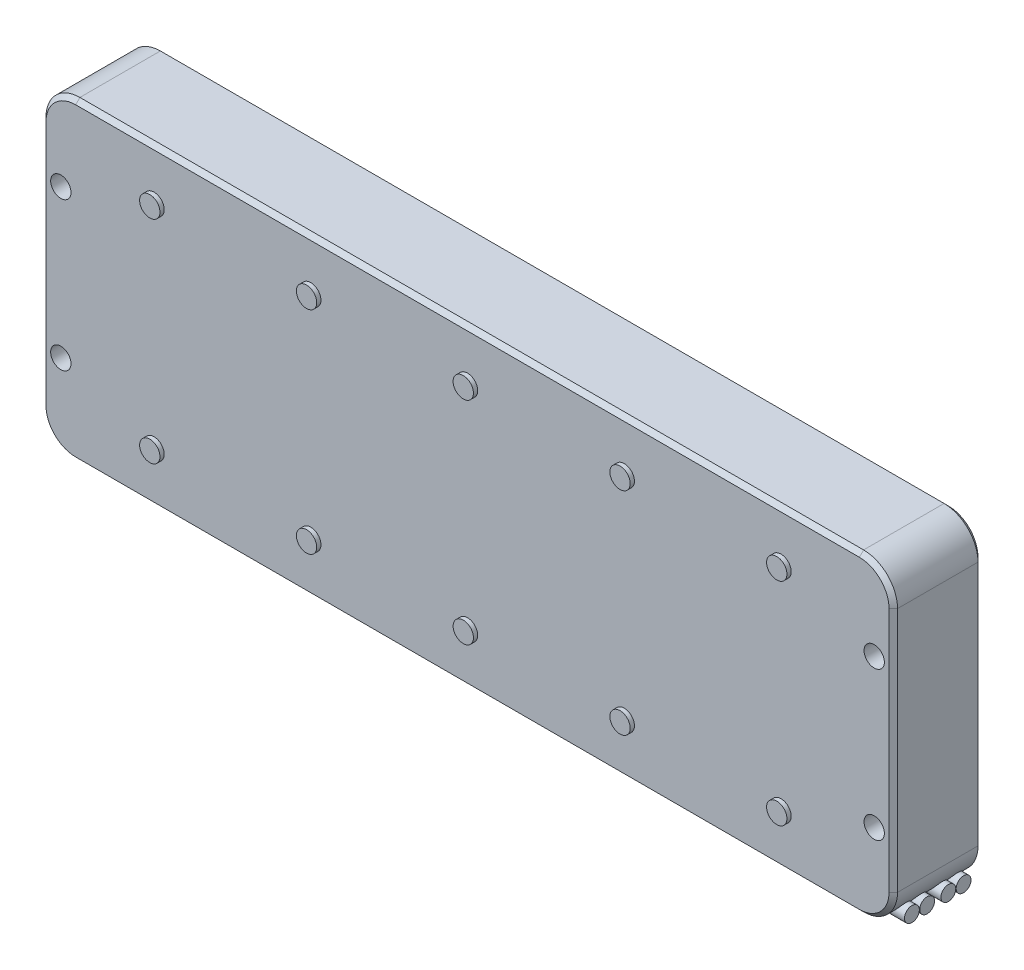
from build123d import *

# Parameters (mm, degrees)
SKETCH1_W           = 201
SKETCH1_H           = 74
BOSS_EXTRUDE1_DEPTH = 21
FILLET1_R           = 8
CHAMFER1_SIZE       = 1
CUT_EXTRUDE1_REACH  = 111.134
SKETCH2_R           = 2.4
SKETCH3_R           = 2.4
BOSS_EXTRUDE2_DEPTH = 1
BOSS_EXTRUDE6_REACH = 207.558
SKETCH4_R           = 1.75
SKETCH5_R           = 2.4
CUT_EXTRUDE2_DEPTH  = 1
SKETCH6_W           = 13
SKETCH6_H           = 9
CUT_EXTRUDE3_DEPTH  = 2.4
SKETCH7_R           = 2
BOSS_EXTRUDE7_DEPTH = 1.25
FILLET2_R           = 2.5
SKETCH8_R           = 2.5
CUT_EXTRUDE4_DEPTH  = 0.25
LPATTERN1_COUNT     = 5
LPATTERN1_PITCH     = 25


with BuildPart() as part:
    # Sketch1 → Boss-Extrude1 (new body)
    with BuildSketch(Plane.XY):
        Rectangle(SKETCH1_W, SKETCH1_H)
    extrude(amount=BOSS_EXTRUDE1_DEPTH)

    # Fillet1
    fillet1_edges = [part.edges().sort_by_distance(p)[0] for p in [
        (100.5, -37, 10.5),
        (-100.5, -37, 10.5),
        (-100.5, 37, 10.5),
        (100.5, 37, 10.5),
    ]]
    fillet(fillet1_edges, radius=FILLET1_R)

    # Chamfer1
    chamfer1_edges = [part.edges().sort_by_distance(p)[0] for p in [
        (0, 37, 0),
        (0, 37, 21),
        (100.5, 0, 0),
        (0, -37, 0),
        (-100.5, 0, 0),
        (-98.156854249, 34.656854249, 0),
        (-98.156854249, -34.656854249, 0),
        (98.156854249, -34.656854249, 0),
        (98.156854249, 34.656854249, 0),
        (100.5, 0, 21),
        (-100.5, 0, 21),
        (0, -37, 21),
        (-98.156854249, 34.656854249, 21),
        (-98.156854249, -34.656854249, 21),
        (98.156854249, -34.656854249, 21),
        (98.156854249, 34.656854249, 21),
    ]]
    chamfer(chamfer1_edges, length=CHAMFER1_SIZE)

    # Sketch2 → Cut-Extrude1 (cut, up to next)
    with BuildSketch(Plane.XY.offset(21), mode=Mode.PRIVATE) as cut_extrude1_sk1:
        with Locations((-96, 17.5)):
            Circle(SKETCH2_R)
    cut_extrude1_tool1 = extrude(cut_extrude1_sk1.sketch, amount=-CUT_EXTRUDE1_REACH, mode=Mode.PRIVATE) & part.part
    # Sketch2 → Cut-Extrude1 (cut, up to next)
    with BuildSketch(Plane.XY.offset(21), mode=Mode.PRIVATE) as cut_extrude1_sk2:
        with Locations((-96, -17.5)):
            Circle(SKETCH2_R)
    cut_extrude1_tool2 = extrude(cut_extrude1_sk2.sketch, amount=-CUT_EXTRUDE1_REACH, mode=Mode.PRIVATE) & part.part
    # Sketch2 → Cut-Extrude1 (cut, up to next)
    with BuildSketch(Plane.XY.offset(21), mode=Mode.PRIVATE) as cut_extrude1_sk3:
        with Locations(Location((96, 17.5, 0), (0, 0, 180))):
            Circle(SKETCH2_R)
    cut_extrude1_tool3 = extrude(cut_extrude1_sk3.sketch, amount=-CUT_EXTRUDE1_REACH, mode=Mode.PRIVATE) & part.part
    # Sketch2 → Cut-Extrude1 (cut, up to next)
    with BuildSketch(Plane.XY.offset(21), mode=Mode.PRIVATE) as cut_extrude1_sk4:
        with Locations(Location((96, -17.5, 0), (0, 0, 180))):
            Circle(SKETCH2_R)
    cut_extrude1_tool4 = extrude(cut_extrude1_sk4.sketch, amount=-CUT_EXTRUDE1_REACH, mode=Mode.PRIVATE) & part.part
    add(cut_extrude1_tool1.solids().sort_by_distance((-96, 17.5, 21))[0], mode=Mode.SUBTRACT)
    add(cut_extrude1_tool2.solids().sort_by_distance((-96, -17.5, 21))[0], mode=Mode.SUBTRACT)
    add(cut_extrude1_tool3.solids().sort_by_distance((96, 17.5, 21))[0], mode=Mode.SUBTRACT)
    add(cut_extrude1_tool4.solids().sort_by_distance((96, -17.5, 21))[0], mode=Mode.SUBTRACT)

    # Sketch3 → Boss-Extrude2 (add)
    with BuildSketch(Plane.XY.offset(21)):
        with Locations(Location((0, 25, 0), (0, 0, 180))):
            Circle(SKETCH3_R)
        with Locations(Location((0, -25, 0), (0, 0, 180))):
            Circle(SKETCH3_R)
        with Locations(Location((-74, 25, 0), (0, 0, 180))):
            Circle(SKETCH3_R)
        with Locations(Location((-37, 25, 0), (0, 0, 180))):
            Circle(SKETCH3_R)
        with Locations(Location((37, 25, 0), (0, 0, 180))):
            Circle(SKETCH3_R)
        with Locations(Location((74, 25, 0), (0, 0, 180))):
            Circle(SKETCH3_R)
        with Locations(Location((74, -25, 0), (0, 0, 180))):
            Circle(SKETCH3_R)
        with Locations(Location((37, -25, 0), (0, 0, 180))):
            Circle(SKETCH3_R)
        with Locations(Location((-37, -25, 0), (0, 0, 180))):
            Circle(SKETCH3_R)
        with Locations(Location((-74, -25, 0), (0, 0, 180))):
            Circle(SKETCH3_R)
    extrude(amount=BOSS_EXTRUDE2_DEPTH)

    # Sketch4 → Boss-Extrude6 (add, up to next)
    with BuildSketch(Plane(origin=(100.5, 0, 0), x_dir=(0, 0, -1), z_dir=(1, 0, 0)), mode=Mode.PRIVATE) as boss_extrude6_sk1:
        with Locations((-16.6, -35.15)):
            Circle(SKETCH4_R)
    boss_extrude6_tool1 = extrude(boss_extrude6_sk1.sketch, amount=-BOSS_EXTRUDE6_REACH, mode=Mode.PRIVATE) - part.part
    # Sketch4 → Boss-Extrude6 (add, up to next)
    with BuildSketch(Plane(origin=(100.5, 0, 0), x_dir=(0, 0, -1), z_dir=(1, 0, 0)), mode=Mode.PRIVATE) as boss_extrude6_sk2:
        with Locations((-13, -35.15)):
            Circle(SKETCH4_R)
    boss_extrude6_tool2 = extrude(boss_extrude6_sk2.sketch, amount=-BOSS_EXTRUDE6_REACH, mode=Mode.PRIVATE) - part.part
    # Sketch4 → Boss-Extrude6 (add, up to next)
    with BuildSketch(Plane(origin=(100.5, 0, 0), x_dir=(0, 0, -1), z_dir=(1, 0, 0)), mode=Mode.PRIVATE) as boss_extrude6_sk3:
        with Locations((-8, -35.15)):
            Circle(SKETCH4_R)
    boss_extrude6_tool3 = extrude(boss_extrude6_sk3.sketch, amount=-BOSS_EXTRUDE6_REACH, mode=Mode.PRIVATE) - part.part
    # Sketch4 → Boss-Extrude6 (add, up to next)
    with BuildSketch(Plane(origin=(100.5, 0, 0), x_dir=(0, 0, -1), z_dir=(1, 0, 0)), mode=Mode.PRIVATE) as boss_extrude6_sk4:
        with Locations((-4.4, -35.15)):
            Circle(SKETCH4_R)
    boss_extrude6_tool4 = extrude(boss_extrude6_sk4.sketch, amount=-BOSS_EXTRUDE6_REACH, mode=Mode.PRIVATE) - part.part
    add(boss_extrude6_tool1.solids().sort_by_distance((100.5, -35.15, 16.6))[0])
    add(boss_extrude6_tool2.solids().sort_by_distance((100.5, -35.15, 13))[0])
    add(boss_extrude6_tool3.solids().sort_by_distance((100.5, -35.15, 8))[0])
    add(boss_extrude6_tool4.solids().sort_by_distance((100.5, -35.15, 4.4))[0])

    # Sketch5 → Cut-Extrude2 (cut)
    with BuildSketch(Plane(origin=(0, 0, 0), x_dir=(-1, 0, 0), z_dir=(0, 0, -1))):
        with Locations((0, 25)):
            Circle(SKETCH5_R)
        with Locations((0, -25)):
            Circle(SKETCH5_R)
        with Locations((-74, 25)):
            Circle(SKETCH5_R)
        with Locations((-37, 25)):
            Circle(SKETCH5_R)
        with Locations((37, 25)):
            Circle(SKETCH5_R)
        with Locations((74, 25)):
            Circle(SKETCH5_R)
        with Locations((74, -25)):
            Circle(SKETCH5_R)
        with Locations((37, -25)):
            Circle(SKETCH5_R)
        with Locations((-37, -25)):
            Circle(SKETCH5_R)
        with Locations((-74, -25)):
            Circle(SKETCH5_R)
    extrude(amount=-CUT_EXTRUDE2_DEPTH, mode=Mode.SUBTRACT)

    # Sketch6 → Cut-Extrude3 (cut)
    with BuildSketch(Plane.XZ.offset(37)):
        with Locations((-63, 10.5)):
            Rectangle(SKETCH6_W, SKETCH6_H)
    extrude(amount=-CUT_EXTRUDE3_DEPTH, mode=Mode.SUBTRACT)

    # Sketch7 → Boss-Extrude7 (add)
    with BuildSketch(Plane.XZ.offset(34.6)):
        with Locations(Location((-63, 10.5, 0), (0, 0, 270))):
            Circle(SKETCH7_R)
    extrude(amount=BOSS_EXTRUDE7_DEPTH)

    # Fillet2
    fillet2_edges = [part.edges().sort_by_distance(p)[0] for p in [
        (-56.5, -35.8, 15),
        (-56.5, -35.8, 6),
        (-69.5, -35.8, 6),
        (-69.5, -35.8, 15),
    ]]
    fillet(fillet2_edges, radius=FILLET2_R)

    # Sketch8 → Cut-Extrude4 (cut)
    with BuildSketch(Plane.XZ.offset(37)):
        with Locations(Location((55.5, 6, 0), (0, 0, 270))):
            Circle(SKETCH8_R)
    cut_extrude4 = extrude(amount=-CUT_EXTRUDE4_DEPTH, mode=Mode.SUBTRACT)

    # LPattern1: Cut-Extrude4 ×5
    with Locations(*[(-i * LPATTERN1_PITCH, 0, 0) for i in range(1, LPATTERN1_COUNT)]):
        add(cut_extrude4, mode=Mode.SUBTRACT)


solid = part.part
